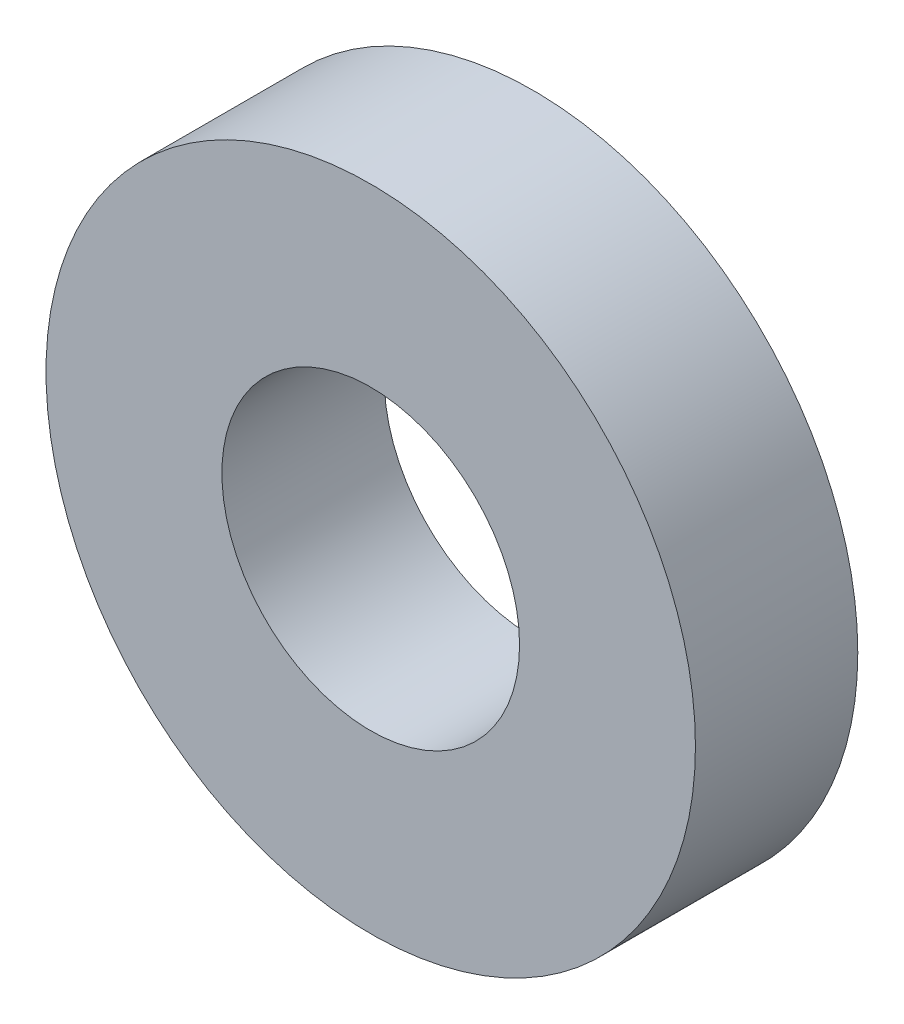
from build123d import *

# Parameters (mm, degrees)
SKETCH_1_R                  = 24
LIFTING_EYE_ENVELOPE_DEPTH  = 12
SKETCH_2_R                  = 11
SHACKLE_PIN_CLEARANCE_DEPTH = 37


with BuildPart() as part:
    # 草图1 → Lifting_eye_envelope (new body)
    with BuildSketch(Plane.XY):
        Circle(SKETCH_1_R)
    extrude(amount=LIFTING_EYE_ENVELOPE_DEPTH)

    # 草图2 → Shackle_pin_clearance (cut, through all)
    with BuildSketch(Plane.XY.offset(12)):
        Circle(SKETCH_2_R)
    extrude(amount=-SHACKLE_PIN_CLEARANCE_DEPTH, mode=Mode.SUBTRACT)


solid = part.part
